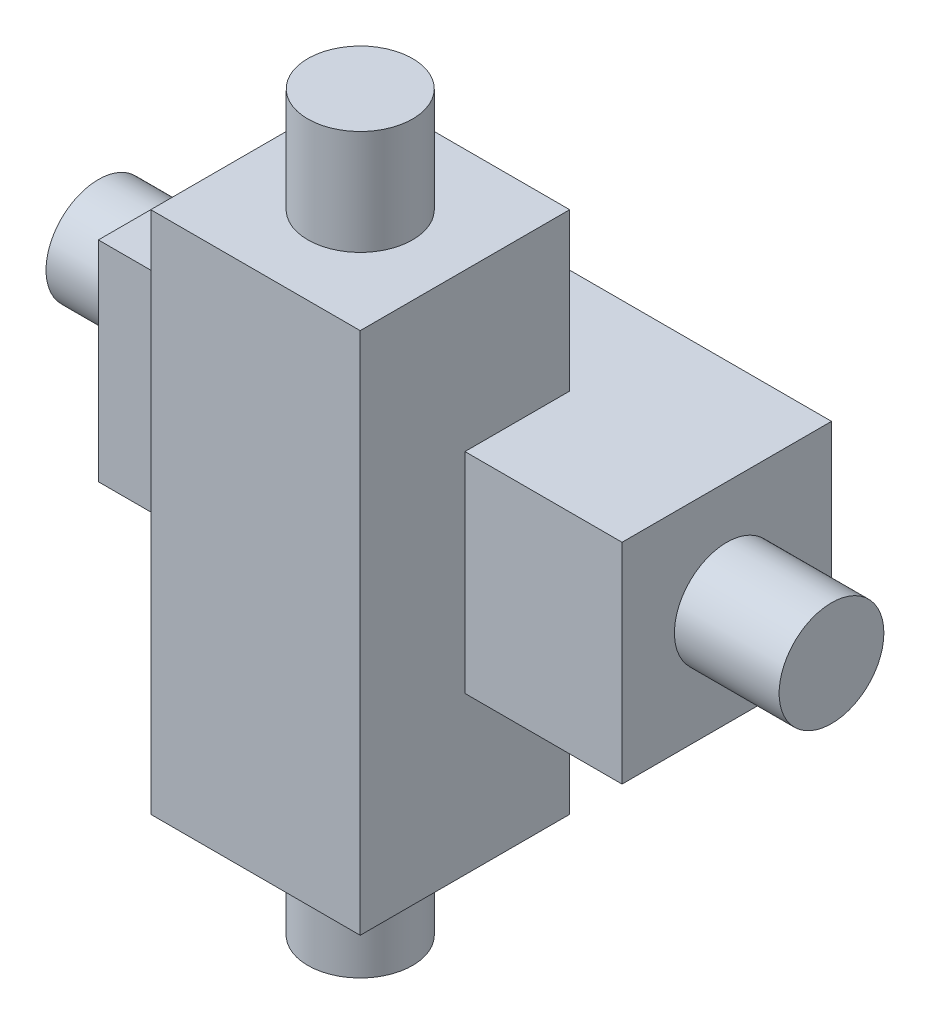
from build123d import *

# Parameters (mm, degrees)
SKETCH1_W           = 2
SKETCH1_H           = 2
BOSS_EXTRUDE1_DEPTH = 2.5
SKETCH2_W           = 2
SKETCH2_H           = 2
BOSS_EXTRUDE2_DEPTH = 2.5
SKETCH3_R           = 0.5
BOSS_EXTRUDE3_DEPTH = 3.5
SKETCH5_R           = 0.5
BOSS_EXTRUDE4_DEPTH = 3.5


with BuildPart() as part:
    # Sketch1 → Boss-Extrude1 (new, symmetric)
    with BuildSketch(Plane(origin=(0, 0, 0), x_dir=(1, 0, 0), z_dir=(0, 1, 0))):
        Rectangle(SKETCH1_W, SKETCH1_H)
    extrude(amount=BOSS_EXTRUDE1_DEPTH, both=True)

    # Sketch2 → Boss-Extrude2 (add, symmetric)
    with BuildSketch(Plane(origin=(0, 0, 0), x_dir=(0, 0, -1), z_dir=(1, 0, 0))):
        with Locations((1, 0)):
            Rectangle(SKETCH2_W, SKETCH2_H)
    extrude(amount=BOSS_EXTRUDE2_DEPTH, both=True)

    # Sketch3 → Boss-Extrude3 (add, symmetric)
    with BuildSketch(Plane(origin=(0, 0, 0), x_dir=(1, 0, 0), z_dir=(0, 1, 0))):
        with Locations(Location((0, 0, 0), (0, 0, 270))):
            Circle(SKETCH3_R)
    extrude(amount=BOSS_EXTRUDE3_DEPTH, both=True)

    # Sketch5 → Boss-Extrude4 (add, symmetric)
    with BuildSketch(Plane(origin=(0, 0, 0), x_dir=(0, 0, -1), z_dir=(1, 0, 0))):
        with Locations((1, 0)):
            Circle(SKETCH5_R)
    extrude(amount=BOSS_EXTRUDE4_DEPTH, both=True)


solid = part.part
